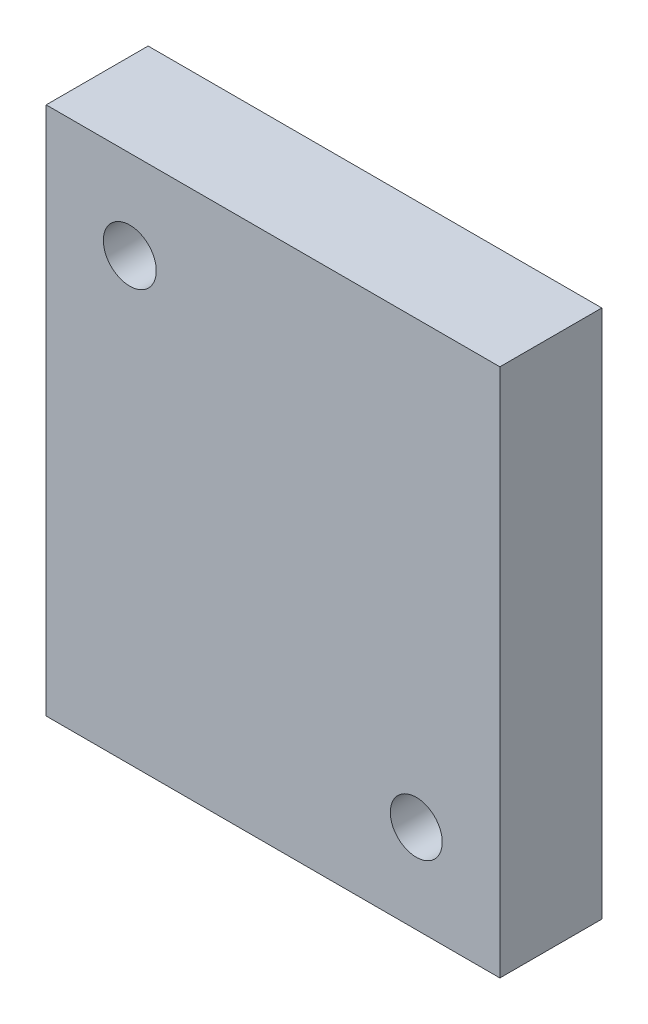
from build123d import *

# Parameters (mm, degrees)
SKETCH1_W           = 60
SKETCH1_H           = 70
BOSS_EXTRUDE1_DEPTH = 13.48
SKETCH2_R           = 3.43487198
SKETCH2_R_2         = 3.5
CUT_EXTRUDE1_DEPTH  = 29


with BuildPart() as part:
    # Sketch1 → Boss-Extrude1 (new body)
    with BuildSketch(Plane.XY):
        Rectangle(SKETCH1_W, SKETCH1_H)
    extrude(amount=BOSS_EXTRUDE1_DEPTH)

    # Sketch2 → Cut-Extrude1 (cut)
    with BuildSketch(Plane(origin=(0, 0, 0), x_dir=(-1, 0, 0), z_dir=(0, 0, -1))):
        with Locations((-18.942541231, -23.26327861)):
            Circle(SKETCH2_R)
        with Locations((18.942541231, 23.26327861)):
            Circle(SKETCH2_R_2)
    extrude(amount=-CUT_EXTRUDE1_DEPTH, mode=Mode.SUBTRACT)


solid = part.part
